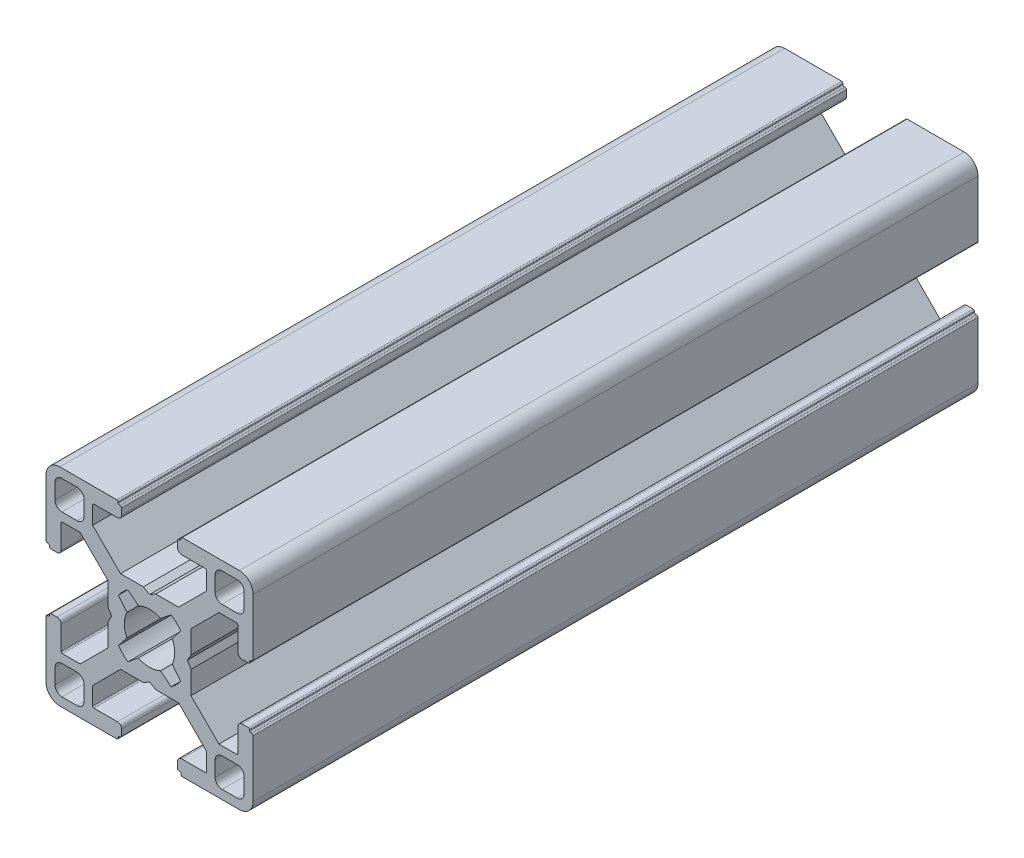
from build123d import *

# Parameters (mm, degrees)
BASE_EXTRUDE_DEPTH = 105


with BuildPart() as part:
    # Sketch1 → Base-Extrude (new body)
    with BuildSketch(Plane.XY):
        with BuildLine():
            Line((6.00446543, 0.899999619), (5.484852164, 0))
            Line((5.484852164, 0), (6.00446543, -0.899999619))
            Line((6.00446543, -0.899999619), (6.00446543, -4.204465866))
            Line((6.00446543, -4.204465866), (10.049999564, -8.25))
            Line((10.049999564, -8.25), (12.59999928, -8.25))
            ThreePointArc((12.59999928, -8.25), (12.741420837, -8.191421273), (12.799999564, -8.049999716))
            Line((12.799999564, -8.049999716), (12.799999564, -4.649999613))
            ThreePointArc((12.799999564, -4.649999613), (12.975735606, -4.225735278), (13.39999994, -4.049999237))
            Line((13.39999994, -4.049999237), (14.300000043, -4.049999237))
            ThreePointArc((14.300000043, -4.049999237), (14.4414216, -4.108577964), (14.500000327, -4.249999521))
            Line((14.500000327, -4.249999521), (14.500000327, -4.349998953))
            ThreePointArc((14.500000327, -4.349998953), (14.558579054, -4.49142051), (14.700000611, -4.549999237))
            Line((14.700000611, -4.549999237), (14.799999716, -4.549999237))
            ThreePointArc((14.799999716, -4.549999237), (14.941421273, -4.608577964), (15, -4.749999521))
            Line((15, -4.749999521), (15, -13.000000346))
            ThreePointArc((15, -13.000000346), (14.414213664, -14.414213664), (13.000000346, -15))
            Line((13.000000346, -15), (4.749999945, -15))
            ThreePointArc((4.749999945, -15), (4.60857832, -14.941421245), (4.549999564, -14.799999619))
            Line((4.549999564, -14.799999619), (4.549999564, -14.69999942))
            ThreePointArc((4.549999564, -14.69999942), (4.49142109, -14.558578474), (4.350000144, -14.5))
            Line((4.350000144, -14.5), (4.250000374, -14.5))
            ThreePointArc((4.250000374, -14.5), (4.108578753, -14.441421247), (4.05, -14.299999626))
            Line((4.05, -14.299999626), (4.05, -13.399999434))
            ThreePointArc((4.05, -13.399999434), (4.225735989, -12.975735226), (4.650000197, -12.799999237))
            Line((4.650000197, -12.799999237), (8.049999924, -12.799999237))
            ThreePointArc((8.049999924, -12.799999237), (8.191421565, -12.741420475), (8.250000327, -12.599998834))
            Line((8.250000327, -12.599998834), (8.250000327, -10.049999237))
            Line((8.250000327, -10.049999237), (4.204466193, -6))
            Line((4.204466193, -6), (0.899999946, -6))
            Line((0.899999946, -6), (0, -5.484851837))
            Line((0, -5.484851837), (-0.899999946, -6))
            Line((-0.899999946, -6), (-4.204466193, -6))
            Line((-4.204466193, -6), (-8.250000327, -10.049999237))
            Line((-8.250000327, -10.049999237), (-8.250000327, -12.599998834))
            ThreePointArc((-8.250000327, -12.599998834), (-8.191421565, -12.741420475), (-8.049999924, -12.799999237))
            Line((-8.049999924, -12.799999237), (-4.650000197, -12.799999237))
            ThreePointArc((-4.650000197, -12.799999237), (-4.225735989, -12.975735226), (-4.05, -13.399999434))
            Line((-4.05, -13.399999434), (-4.05, -14.299999626))
            ThreePointArc((-4.05, -14.299999626), (-4.108578753, -14.441421247), (-4.250000374, -14.5))
            Line((-4.250000374, -14.5), (-4.350000144, -14.5))
            ThreePointArc((-4.350000144, -14.5), (-4.49142109, -14.558578474), (-4.549999564, -14.69999942))
            Line((-4.549999564, -14.69999942), (-4.549999564, -14.799999619))
            ThreePointArc((-4.549999564, -14.799999619), (-4.60857832, -14.941421245), (-4.749999945, -15))
            Line((-4.749999945, -15), (-13.000000346, -15))
            ThreePointArc((-13.000000346, -15), (-14.414213664, -14.414213664), (-15, -13.000000346))
            Line((-15, -13.000000346), (-15, -4.749999521))
            ThreePointArc((-15, -4.749999521), (-14.941421273, -4.608577964), (-14.799999716, -4.549999237))
            Line((-14.799999716, -4.549999237), (-14.700000611, -4.549999237))
            ThreePointArc((-14.700000611, -4.549999237), (-14.558579054, -4.49142051), (-14.500000327, -4.349998953))
            Line((-14.500000327, -4.349998953), (-14.500000327, -4.249999521))
            ThreePointArc((-14.500000327, -4.249999521), (-14.4414216, -4.108577964), (-14.300000043, -4.049999237))
            Line((-14.300000043, -4.049999237), (-13.39999994, -4.049999237))
            ThreePointArc((-13.39999994, -4.049999237), (-12.975735606, -4.225735278), (-12.799999564, -4.649999613))
            Line((-12.799999564, -4.649999613), (-12.799999564, -8.049999716))
            ThreePointArc((-12.799999564, -8.049999716), (-12.741420837, -8.191421273), (-12.59999928, -8.25))
            Line((-12.59999928, -8.25), (-10.049999564, -8.25))
            Line((-10.049999564, -8.25), (-6.00446543, -4.204465866))
            Line((-6.00446543, -4.204465866), (-6.00446543, -0.899999619))
            Line((-6.00446543, -0.899999619), (-5.484852164, 0))
            Line((-5.484852164, 0), (-6.00446543, 0.899999619))
            Line((-6.00446543, 0.899999619), (-6.00446543, 4.204465866))
            Line((-6.00446543, 4.204465866), (-10.049999564, 8.25))
            Line((-10.049999564, 8.25), (-12.59999928, 8.25))
            ThreePointArc((-12.59999928, 8.25), (-12.741420837, 8.191421273), (-12.799999564, 8.049999716))
            Line((-12.799999564, 8.049999716), (-12.799999564, 4.649999613))
            ThreePointArc((-12.799999564, 4.649999613), (-12.975735606, 4.225735278), (-13.39999994, 4.049999237))
            Line((-13.39999994, 4.049999237), (-14.300000043, 4.049999237))
            ThreePointArc((-14.300000043, 4.049999237), (-14.4414216, 4.108577964), (-14.500000327, 4.249999521))
            Line((-14.500000327, 4.249999521), (-14.500000327, 4.349998953))
            ThreePointArc((-14.500000327, 4.349998953), (-14.558579054, 4.49142051), (-14.700000611, 4.549999237))
            Line((-14.700000611, 4.549999237), (-14.799999716, 4.549999237))
            ThreePointArc((-14.799999716, 4.549999237), (-14.941421273, 4.608577964), (-15, 4.749999521))
            Line((-15, 4.749999521), (-15, 13.000000346))
            ThreePointArc((-15, 13.000000346), (-14.414213664, 14.414213664), (-13.000000346, 15))
            Line((-13.000000346, 15), (-4.749999945, 15))
            ThreePointArc((-4.749999945, 15), (-4.60857832, 14.941421245), (-4.549999564, 14.799999619))
            Line((-4.549999564, 14.799999619), (-4.549999564, 14.69999942))
            ThreePointArc((-4.549999564, 14.69999942), (-4.49142109, 14.558578474), (-4.350000144, 14.5))
            Line((-4.350000144, 14.5), (-4.250000374, 14.5))
            ThreePointArc((-4.250000374, 14.5), (-4.108578753, 14.441421247), (-4.05, 14.299999626))
            Line((-4.05, 14.299999626), (-4.05, 13.399999434))
            ThreePointArc((-4.05, 13.399999434), (-4.225735989, 12.975735226), (-4.650000197, 12.799999237))
            Line((-4.650000197, 12.799999237), (-8.049999924, 12.799999237))
            ThreePointArc((-8.049999924, 12.799999237), (-8.191421565, 12.741420475), (-8.250000327, 12.599998834))
            Line((-8.250000327, 12.599998834), (-8.250000327, 10.049999237))
            Line((-8.250000327, 10.049999237), (-4.204466193, 6))
            Line((-4.204466193, 6), (-0.899999946, 6))
            Line((-0.899999946, 6), (0, 5.484851837))
            Line((0, 5.484851837), (0.899999946, 6))
            Line((0.899999946, 6), (4.204466193, 6))
            Line((4.204466193, 6), (8.250000327, 10.049999237))
            Line((8.250000327, 10.049999237), (8.250000327, 12.599998834))
            ThreePointArc((8.250000327, 12.599998834), (8.191421565, 12.741420475), (8.049999924, 12.799999237))
            Line((8.049999924, 12.799999237), (4.650000197, 12.799999237))
            ThreePointArc((4.650000197, 12.799999237), (4.225735989, 12.975735226), (4.05, 13.399999434))
            Line((4.05, 13.399999434), (4.05, 14.299999626))
            ThreePointArc((4.05, 14.299999626), (4.108578753, 14.441421247), (4.250000374, 14.5))
            Line((4.250000374, 14.5), (4.350000144, 14.5))
            ThreePointArc((4.350000144, 14.5), (4.49142109, 14.558578474), (4.549999564, 14.69999942))
            Line((4.549999564, 14.69999942), (4.549999564, 14.799999619))
            ThreePointArc((4.549999564, 14.799999619), (4.60857832, 14.941421245), (4.749999945, 15))
            Line((4.749999945, 15), (13.000000346, 15))
            ThreePointArc((13.000000346, 15), (14.414213664, 14.414213664), (15, 13.000000346))
            Line((15, 13.000000346), (15, 4.749999521))
            ThreePointArc((15, 4.749999521), (14.941421273, 4.608577964), (14.799999716, 4.549999237))
            Line((14.799999716, 4.549999237), (14.700000611, 4.549999237))
            ThreePointArc((14.700000611, 4.549999237), (14.558579054, 4.49142051), (14.500000327, 4.349998953))
            Line((14.500000327, 4.349998953), (14.500000327, 4.249999521))
            ThreePointArc((14.500000327, 4.249999521), (14.4414216, 4.108577964), (14.300000043, 4.049999237))
            Line((14.300000043, 4.049999237), (13.39999994, 4.049999237))
            ThreePointArc((13.39999994, 4.049999237), (12.975735606, 4.225735278), (12.799999564, 4.649999613))
            Line((12.799999564, 4.649999613), (12.799999564, 8.049999716))
            ThreePointArc((12.799999564, 8.049999716), (12.741420837, 8.191421273), (12.59999928, 8.25))
            Line((12.59999928, 8.25), (10.049999564, 8.25))
            Line((10.049999564, 8.25), (6.00446543, 4.204465866))
            Line((6.00446543, 4.204465866), (6.00446543, 0.899999619))
        make_face()
        with BuildLine():
            Line((13.70000109, 12.700000398), (13.70000109, 10.499999635))
            ThreePointArc((13.70000109, 10.499999635), (13.407107874, 9.792892851), (12.70000109, 9.499999635))
            Line((12.70000109, 9.499999635), (10.500000327, 9.499999635))
            ThreePointArc((10.500000327, 9.499999635), (9.792893543, 9.792892851), (9.500000327, 10.499999635))
            Line((9.500000327, 10.499999635), (9.500000327, 12.700000398))
            ThreePointArc((9.500000327, 12.700000398), (9.792893543, 13.407107182), (10.500000327, 13.700000398))
            Line((10.500000327, 13.700000398), (12.70000109, 13.700000398))
            ThreePointArc((12.70000109, 13.700000398), (13.407107874, 13.407107182), (13.70000109, 12.700000398))
        make_face(mode=Mode.SUBTRACT)
        with BuildLine():
            Line((3.135929412, 4.518400903), (1.600129524, 3.280561767))
            ThreePointArc((1.600129524, 3.280561767), (0, 3.65), (-1.600129524, 3.280561767))
            Line((-1.600129524, 3.280561767), (-3.135929412, 4.518400903))
            ThreePointArc((-3.135929412, 4.518400903), (-3.881002259, 3.897155561), (-4.505336892, 3.154669473))
            Line((-4.505336892, 3.154669473), (-3.280561732, 1.600129597))
            ThreePointArc((-3.280561732, 1.600129597), (-3.65, 0), (-3.280561732, -1.600129597))
            Line((-3.280561732, -1.600129597), (-4.505336892, -3.154669473))
            ThreePointArc((-4.505336892, -3.154669473), (-3.881002259, -3.897155561), (-3.135929412, -4.518400903))
            Line((-3.135929412, -4.518400903), (-1.600129524, -3.280561767))
            ThreePointArc((-1.600129524, -3.280561767), (0, -3.65), (1.600129524, -3.280561767))
            Line((1.600129524, -3.280561767), (3.135929412, -4.518400903))
            ThreePointArc((3.135929412, -4.518400903), (3.881002259, -3.897155561), (4.505336892, -3.154669473))
            Line((4.505336892, -3.154669473), (3.280561732, -1.600129597))
            ThreePointArc((3.280561732, -1.600129597), (3.65, 0), (3.280561732, 1.600129597))
            Line((3.280561732, 1.600129597), (4.505336892, 3.154669473))
            ThreePointArc((4.505336892, 3.154669473), (3.881002259, 3.897155561), (3.135929412, 4.518400903))
        make_face(mode=Mode.SUBTRACT)
        with BuildLine():
            Line((-13.70000109, -12.700000398), (-13.70000109, -10.499999635))
            ThreePointArc((-13.70000109, -10.499999635), (-13.407107874, -9.792892851), (-12.70000109, -9.499999635))
            Line((-12.70000109, -9.499999635), (-10.500000327, -9.499999635))
            ThreePointArc((-10.500000327, -9.499999635), (-9.792893543, -9.792892851), (-9.500000327, -10.499999635))
            Line((-9.500000327, -10.499999635), (-9.500000327, -12.700000398))
            ThreePointArc((-9.500000327, -12.700000398), (-9.792893543, -13.407107182), (-10.500000327, -13.700000398))
            Line((-10.500000327, -13.700000398), (-12.70000109, -13.700000398))
            ThreePointArc((-12.70000109, -13.700000398), (-13.407107874, -13.407107182), (-13.70000109, -12.700000398))
        make_face(mode=Mode.SUBTRACT)
        with BuildLine():
            Line((10.500000327, -13.700000398), (12.70000109, -13.700000398))
            ThreePointArc((12.70000109, -13.700000398), (13.407107874, -13.407107182), (13.70000109, -12.700000398))
            Line((13.70000109, -12.700000398), (13.70000109, -10.499999635))
            ThreePointArc((13.70000109, -10.499999635), (13.407107874, -9.792892851), (12.70000109, -9.499999635))
            Line((12.70000109, -9.499999635), (10.500000327, -9.499999635))
            ThreePointArc((10.500000327, -9.499999635), (9.792893543, -9.792892851), (9.500000327, -10.499999635))
            Line((9.500000327, -10.499999635), (9.500000327, -12.700000398))
            ThreePointArc((9.500000327, -12.700000398), (9.792893543, -13.407107182), (10.500000327, -13.700000398))
        make_face(mode=Mode.SUBTRACT)
        with BuildLine():
            Line((-10.500000327, 13.700000398), (-12.70000109, 13.700000398))
            ThreePointArc((-12.70000109, 13.700000398), (-13.407107874, 13.407107182), (-13.70000109, 12.700000398))
            Line((-13.70000109, 12.700000398), (-13.70000109, 10.499999635))
            ThreePointArc((-13.70000109, 10.499999635), (-13.407107874, 9.792892851), (-12.70000109, 9.499999635))
            Line((-12.70000109, 9.499999635), (-10.500000327, 9.499999635))
            ThreePointArc((-10.500000327, 9.499999635), (-9.792893543, 9.792892851), (-9.500000327, 10.499999635))
            Line((-9.500000327, 10.499999635), (-9.500000327, 12.700000398))
            ThreePointArc((-9.500000327, 12.700000398), (-9.792893543, 13.407107182), (-10.500000327, 13.700000398))
        make_face(mode=Mode.SUBTRACT)
    extrude(amount=-BASE_EXTRUDE_DEPTH)


solid = part.part
